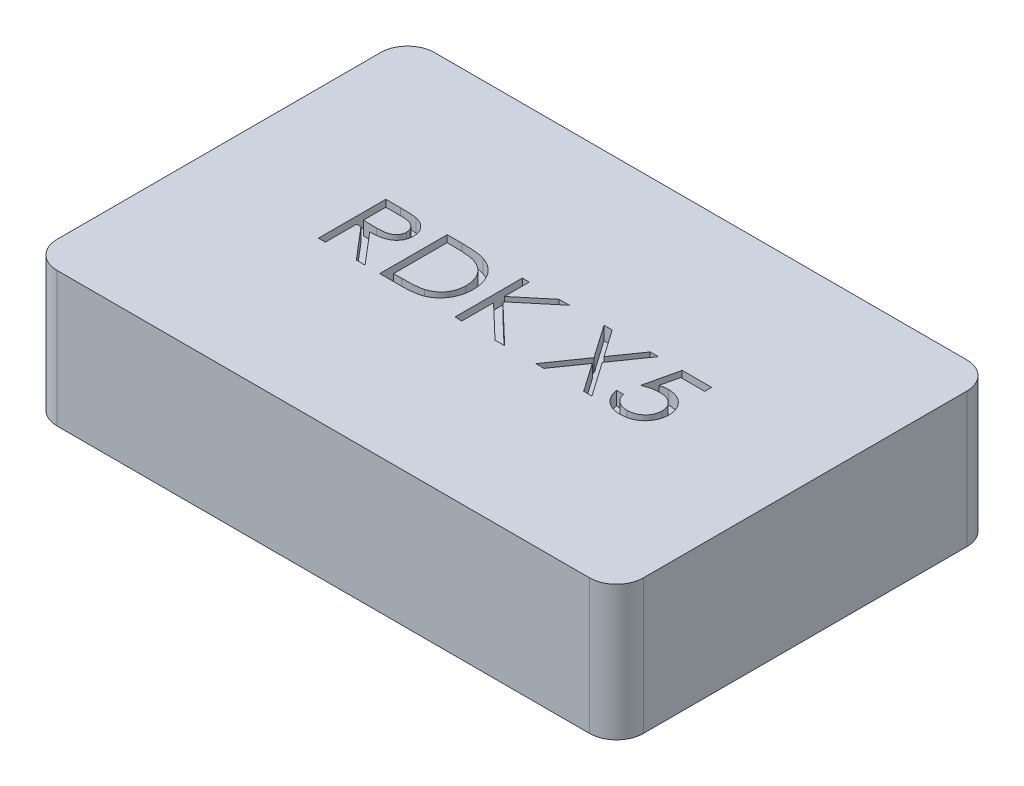
from build123d import *

# Parameters (mm, degrees)
SKETCH_1_W          = 87
SKETCH_1_H          = 56
EXTRUDE_1_DEPTH     = 20
FILLET_1_R          = 4
CUT_EXTRUDE_1_DEPTH = 2


with BuildPart() as part:
    # 草图1 → 凸台-拉伸1 (new body)
    with BuildSketch(Plane(origin=(0, 0, 0), x_dir=(1, 0, 0), z_dir=(0, 1, 0))):
        with Locations((19.168578004, -6.107640773)):
            Rectangle(SKETCH_1_W, SKETCH_1_H)
    extrude(amount=EXTRUDE_1_DEPTH)

    # 圆角1
    fillet_1_edges = [part.edges().sort_by_distance(p)[0] for p in [
        (-24.331421996, 10, -21.892359227),
        (62.668578004, 10, -21.892359227),
        (62.668578004, 10, 34.107640773),
        (-24.331421996, 10, 34.107640773),
    ]]
    fillet(fillet_1_edges, radius=FILLET_1_R)

    # 草图2 → 切除-拉伸1 (cut)
    # profile 1 of 5: a face of its own
    with BuildSketch(Plane(origin=(0, 20, 0), x_dir=(1, 0, 0), z_dir=(0, 1, 0))):
        with BuildLine():
            Line((-5.086722788, -0.572879549), (-2.923261249, -0.572879549))
            add(Edge.make_bspline(
                [(-2.923261249, -0.572879549), (-2.778363571, -0.573320934), (-2.50057369, -0.574167133), (-2.102513656, -0.578955925), (-1.74133814, -0.592548784), (-1.416592457, -0.604317135), (-1.128245794, -0.625823436), (-0.876136351, -0.645891733), (-0.660820705, -0.673220192), (-0.530674522, -0.69786254), (-0.471338172, -0.709097498)],
                knots=[0, 0, 0, 0, 1.414339765, 2.711494627, 3.88531881, 4.942159382, 5.882957806, 6.707302181, 7.410632199, 8, 8, 8, 8], degree=3))
            add(Edge.make_bspline(
                [(-0.471338172, -0.709097498), (-0.39217971, -0.727118538), (-0.236180601, -0.762632949), (-0.011132873, -0.838517799), (0.203372246, -0.926058972), (0.4070652, -1.028059668), (0.597749095, -1.147527371), (0.778375758, -1.279467313), (0.948001128, -1.426181319), (1.102530094, -1.588455044), (1.24633854, -1.760071337), (1.369865639, -1.944336992), (1.475400917, -2.137798329), (1.559421876, -2.341629454), (1.625296482, -2.554257223), (1.674272542, -2.776554138), (1.70195495, -3.008741261), (1.706065457, -3.166959882), (1.708149007, -3.247158396)],
                knots=[0, 0, 0, 0, 1.069961787, 2.10859435, 3.127328182, 4.123628923, 5.108344377, 6.091089374, 7.071029513, 8.061202237, 9.043197423, 10.020086572, 10.981454588, 11.944635557, 12.92219912, 13.913584836, 14.942429197, 16, 16, 16, 16], degree=3))
            add(Edge.make_bspline(
                [(1.708149007, -3.247158396), (1.707167418, -3.314650198), (1.705228873, -3.447940131), (1.684618015, -3.644814677), (1.650739701, -3.834890725), (1.60364341, -4.018652677), (1.547509403, -4.197412582), (1.470971987, -4.368132084), (1.386047608, -4.534164957), (1.254384435, -4.746338434), (1.057556343, -4.991116664), (0.775442435, -5.24896603), (0.44640417, -5.465990633), (0.13889931, -5.614198247), (-0.132845751, -5.710382876), (-0.357028875, -5.777478196), (-0.6011747, -5.829977365), (-0.862983344, -5.87643314), (-1.143799475, -5.911940207), (-1.443172574, -5.937713076), (-1.761227861, -5.953827929), (-1.979732276, -5.956250817), (-2.091931121, -5.957494934)],
                knots=[0, 0, 0, 0, 0.765727938, 1.51224032, 2.243597852, 2.954892557, 3.664246923, 4.366767899, 5.075150103, 5.77963024, 7.197468406, 8.624290223, 10.099748923, 11.655498899, 12.484879315, 13.369704222, 14.309208053, 15.317126835, 16.386797013, 17.520226779, 18.72667245, 20, 20, 20, 20], degree=3))
            Line((-2.091931121, -5.957494934), (1.836354135, -10.572879549))
            Line((1.836354135, -10.572879549), (0.532267597, -10.572879549))
            Line((0.532267597, -10.572879549), (-3.39601766, -5.957494934))
            Line((-3.39601766, -5.957494934), (-4.061081762, -5.957494934))
            Line((-4.061081762, -5.957494934), (-4.061081762, -10.572879549))
            Line((-4.061081762, -10.572879549), (-5.086722788, -10.572879549))
            Line((-5.086722788, -10.572879549), (-5.086722788, -0.572879549))
        make_face()
        with BuildLine():
            Line((-4.061081762, -1.598520575), (-4.061081762, -4.931853908))
            Line((-4.061081762, -4.931853908), (-2.125985608, -4.945876344))
            add(Edge.make_bspline(
                [(-2.125985608, -4.945876344), (-2.035158897, -4.945916152), (-1.859452652, -4.94599316), (-1.60571042, -4.93462199), (-1.369841411, -4.921534242), (-1.152648837, -4.901843435), (-0.953459435, -4.876030864), (-0.772880746, -4.844334721), (-0.610214022, -4.806720265), (-0.420540702, -4.74932722), (-0.208597691, -4.658102328), (0.02171773, -4.525482155), (0.217508872, -4.357476843), (0.385125331, -4.167566968), (0.516639621, -3.955712173), (0.612232033, -3.729400637), (0.673380617, -3.491427616), (0.679450507, -3.327651251), (0.682507981, -3.24515519)],
                knots=[0, 0, 0, 0, 1.174785523, 2.272648088, 3.285089017, 4.230573644, 5.09306652, 5.882666545, 6.601326979, 7.251640612, 8.443701465, 9.578459247, 10.675607977, 11.765284551, 12.843880664, 13.885096452, 14.934698485, 16, 16, 16, 16], degree=3))
            add(Edge.make_bspline(
                [(0.682507981, -3.24515519), (0.678381363, -3.164719582), (0.670198596, -3.00522195), (0.612837972, -2.771602025), (0.514951128, -2.55052413), (0.379400346, -2.345634499), (0.21741271, -2.156795082), (0.024213356, -1.998299093), (-0.190120634, -1.866039301), (-0.389379678, -1.782019439), (-0.567632848, -1.729518123), (-0.7228239, -1.69408289), (-0.898686728, -1.663975245), (-1.095371145, -1.64105525), (-1.312394295, -1.620747812), (-1.55024923, -1.607140768), (-1.808085907, -1.599117863), (-1.98709035, -1.598724533), (-2.07991189, -1.598520575)],
                knots=[0, 0, 0, 0, 1.061949867, 2.105764981, 3.156116539, 4.239743306, 5.339824676, 6.429463685, 7.526039854, 8.656250729, 9.272888371, 9.978850274, 10.757424844, 11.628143348, 12.593452775, 13.635925841, 14.774125383, 16, 16, 16, 16], degree=3))
            Line((-2.07991189, -1.598520575), (-4.061081762, -1.598520575))
        make_face(mode=Mode.SUBTRACT)
    # profile 2 of 5: a face of its own
    with BuildSketch(Plane(origin=(0, 20, 0), x_dir=(1, 0, 0), z_dir=(0, 1, 0))):
        with BuildLine():
            Line((4.015841315, -10.572879549), (4.015841315, -0.572879549))
            Line((4.015841315, -0.572879549), (6.225376571, -0.572879549))
            add(Edge.make_bspline(
                [(6.225376571, -0.572879549), (6.417694759, -0.574141819), (6.789045707, -0.57657916), (7.325422369, -0.592075121), (7.82114055, -0.619419152), (8.275357471, -0.659499632), (8.68923903, -0.708308279), (9.061696613, -0.769744538), (9.393857232, -0.842134295), (9.59843539, -0.904187918), (9.694927853, -0.933456472)],
                knots=[0, 0, 0, 0, 1.318491949, 2.545901884, 3.678445365, 4.721642567, 5.671598565, 6.534823525, 7.308926774, 8, 8, 8, 8], degree=3))
            add(Edge.make_bspline(
                [(9.694927853, -0.933456472), (9.821220395, -0.977576444), (10.070842097, -1.064781139), (10.427829177, -1.22805389), (10.763038591, -1.414803489), (11.078417894, -1.623664518), (11.369677001, -1.85878114), (11.643265297, -2.114412395), (11.892924453, -2.395448058), (12.121760365, -2.697987109), (12.324992302, -3.020190521), (12.504810388, -3.35762679), (12.654931343, -3.711069252), (12.777176612, -4.079740015), (12.873898205, -4.463246319), (12.941242355, -4.862468551), (12.981913074, -5.276225521), (12.98741107, -5.556761282), (12.990200289, -5.699081472)],
                knots=[0, 0, 0, 0, 1.031077272, 2.037960916, 3.02211781, 3.987428184, 4.950718056, 5.905008575, 6.871320757, 7.845447058, 8.826731165, 9.805580991, 10.790585977, 11.783751852, 12.797718923, 13.837143683, 14.902749073, 16, 16, 16, 16], degree=3))
            add(Edge.make_bspline(
                [(12.990200289, -5.699081472), (12.988696042, -5.822700914), (12.985730318, -6.066424872), (12.949684357, -6.425579874), (12.89576744, -6.773368803), (12.822992643, -7.110733073), (12.72373767, -7.436422022), (12.603377609, -7.750751403), (12.463552644, -8.054751572), (12.300328616, -8.343799054), (12.123841339, -8.619820931), (11.929802036, -8.877237336), (11.725111901, -9.116812303), (11.506269263, -9.337877175), (11.274924204, -9.538949469), (11.030974081, -9.722979883), (10.773663866, -9.887407969), (10.501108665, -10.035340867), (10.207895688, -10.164479968), (9.889064473, -10.275020701), (9.542386373, -10.365467655), (9.168543326, -10.44142591), (8.767425872, -10.501596597), (8.338087293, -10.542063087), (7.881042892, -10.569236887), (7.566898637, -10.571642043), (7.405264392, -10.572879549)],
                knots=[0, 0, 0, 0, 1.054853844, 2.079714579, 3.077722325, 4.058242422, 5.022929398, 5.980925057, 6.929583172, 7.876270073, 8.812240688, 9.724213697, 10.625598362, 11.500202141, 12.376883631, 13.239838843, 14.106288196, 14.981059116, 15.884459902, 16.838036739, 17.858370225, 18.940437825, 20.093157368, 21.318780153, 22.620452413, 24, 24, 24, 24], degree=3))
            Line((7.405264392, -10.572879549), (4.015841315, -10.572879549))
        make_face()
        with BuildLine():
            Line((5.04148234, -9.547238524), (6.281466315, -9.547238524))
            add(Edge.make_bspline(
                [(6.281466315, -9.547238524), (6.459758488, -9.546528354), (6.802364099, -9.545163693), (7.294582832, -9.533248723), (7.744748135, -9.513525208), (8.152285787, -9.486432129), (8.5169696, -9.450228906), (8.839375667, -9.40945084), (9.119442684, -9.359650805), (9.289856436, -9.313913304), (9.368405417, -9.292831472)],
                knots=[0, 0, 0, 0, 1.377932993, 2.64783117, 3.804968788, 4.860218214, 5.80403942, 6.636825548, 7.371670635, 8, 8, 8, 8], degree=3))
            add(Edge.make_bspline(
                [(9.368405417, -9.292831472), (9.467017978, -9.26074442), (9.661286497, -9.197532348), (9.941431758, -9.08138495), (10.203485203, -8.943953189), (10.452012874, -8.792897212), (10.680822296, -8.618235726), (10.895336739, -8.428926356), (11.093304233, -8.220150344), (11.275174732, -7.995076874), (11.43715083, -7.75289732), (11.577518755, -7.497079675), (11.698725196, -7.229661104), (11.797524027, -6.948357822), (11.870375889, -6.652821929), (11.924070317, -6.345623946), (11.960198578, -6.025792866), (11.963087478, -5.808023531), (11.964559263, -5.697078267)],
                knots=[0, 0, 0, 0, 1.0399027, 2.048627037, 3.037138908, 4.005479624, 4.961865202, 5.920171752, 6.872350524, 7.84404371, 8.819238837, 9.790447209, 10.767641088, 11.761041459, 12.77625925, 13.816787195, 14.88773541, 16, 16, 16, 16], degree=3))
            add(Edge.make_bspline(
                [(11.964559263, -5.697078267), (11.96209099, -5.580155261), (11.957242471, -5.35047921), (11.923802519, -5.012632167), (11.862685201, -4.688821053), (11.780404783, -4.377515567), (11.677602938, -4.077442118), (11.545250703, -3.792593584), (11.393832405, -3.518732311), (11.216657033, -3.261088687), (11.021150371, -3.01793782), (10.803928133, -2.79524722), (10.568022632, -2.592468092), (10.316002493, -2.406930291), (10.043102296, -2.24528256), (9.754308313, -2.099424096), (9.444476333, -1.977725781), (9.229325331, -1.91224156), (9.120007981, -1.878969293)],
                knots=[0, 0, 0, 0, 1.089998388, 2.141122879, 3.160582858, 4.158627459, 5.140999449, 6.113141423, 7.082948792, 8.055011043, 9.024278859, 9.98833552, 10.950481064, 11.921645981, 12.901668197, 13.903858501, 14.93495903, 16, 16, 16, 16], degree=3))
            add(Edge.make_bspline(
                [(9.120007981, -1.878969293), (9.029454437, -1.855755923), (8.836346684, -1.806252817), (8.522025724, -1.752814369), (8.167905175, -1.705115011), (7.773085506, -1.665152547), (7.337435535, -1.636202521), (6.861231815, -1.614658979), (6.344323861, -1.600035744), (5.986338188, -1.599037984), (5.800697084, -1.598520575)],
                knots=[0, 0, 0, 0, 0.671630374, 1.43226897, 2.289500064, 3.239801583, 4.283712342, 5.427140445, 6.66578882, 8, 8, 8, 8], degree=3))
            Line((5.800697084, -1.598520575), (5.04148234, -1.598520575))
            Line((5.04148234, -1.598520575), (5.04148234, -9.547238524))
        make_face(mode=Mode.SUBTRACT)
    # profile 3 of 5: a face of its own
    with BuildSketch(Plane(origin=(0, 20, 0), x_dir=(1, 0, 0), z_dir=(0, 1, 0))):
        Polygon((15.169687469, -0.572879549), (16.195328494, -0.572879549), (16.195328494, -4.266789806), (20.626418238, -0.572879549), (22.156866956, -0.572879549), (16.774254776, -5.060059037), (22.54148234, -10.572879549), (21.113197084, -10.572879549), (16.195328494, -5.869353908), (16.195328494, -10.572879549), (15.169687469, -10.572879549), align=None)
    # profile 4 of 5: a face of its own
    with BuildSketch(Plane(origin=(0, 20, 0), x_dir=(1, 0, 0), z_dir=(0, 1, 0))):
        Polygon((27.285072084, -0.572879549), (28.505024007, -0.572879549), (31.323533622, -4.607334678), (34.140040033, -0.572879549), (35.361995161, -0.572879549), (31.934511187, -5.482735319), (35.490200289, -10.572879549), (34.272251571, -10.572879549), (31.325536828, -6.354129549), (28.378822084, -10.572879549), (27.156866956, -10.572879549), (30.712556058, -5.478728908), align=None)
    # profile 5 of 5: a face of its own
    with BuildSketch(Plane(origin=(0, 20, 0), x_dir=(1, 0, 0), z_dir=(0, 1, 0))):
        with BuildLine():
            Line((43.246610546, -0.572879549), (43.246610546, -1.598520575))
            Line((43.246610546, -1.598520575), (39.700937469, -1.598520575))
            Line((39.700937469, -1.598520575), (39.089959905, -4.240748139))
            add(Edge.make_bspline(
                [(39.089959905, -4.240748139), (39.201077595, -4.209061697), (39.416394662, -4.147661647), (39.735376731, -4.085326199), (40.036894775, -4.040880462), (40.232974624, -4.036526659), (40.327940674, -4.034418011)],
                knots=[0, 0, 0, 0, 1.100584957, 2.132646227, 3.095596962, 4, 4, 4, 4], degree=3))
            add(Edge.make_bspline(
                [(40.327940674, -4.034418011), (40.444940861, -4.0368504), (40.675129681, -4.041635937), (41.01171814, -4.087033603), (41.332980489, -4.159047155), (41.638357192, -4.259347041), (41.929099325, -4.387501133), (42.20250032, -4.547892094), (42.462506184, -4.733687179), (42.701269453, -4.950353269), (42.918167697, -5.187333227), (43.111440224, -5.440609426), (43.270542381, -5.712775002), (43.405927132, -5.998537252), (43.503888816, -6.303666848), (43.579154089, -6.622889173), (43.623928715, -6.95916497), (43.628762121, -7.188665183), (43.63122593, -7.305651985)],
                knots=[0, 0, 0, 0, 1.077151714, 2.119212705, 3.121851832, 4.105966215, 5.075130764, 6.042439667, 7.020500988, 8.01341629, 9.005912455, 9.976422566, 10.941539175, 11.904595977, 12.882869982, 13.886885156, 14.922848286, 16, 16, 16, 16], degree=3))
            add(Edge.make_bspline(
                [(43.63122593, -7.305651985), (43.629516001, -7.38715886), (43.626118031, -7.549129317), (43.604111273, -7.789485794), (43.565803826, -8.025047009), (43.512073555, -8.25547046), (43.441223142, -8.479954817), (43.357207582, -8.699860453), (43.256010874, -8.913940136), (43.14347661, -9.123767619), (43.01483792, -9.322950437), (42.876851395, -9.51258229), (42.725985742, -9.688519895), (42.565533058, -9.854040514), (42.392754471, -10.005853535), (42.209912687, -10.147143082), (42.0153094, -10.274972752), (41.810463917, -10.391155816), (41.597059125, -10.495972109), (41.373205538, -10.583179947), (41.143433298, -10.659675725), (40.904688987, -10.72247912), (40.657647536, -10.76992836), (40.402061171, -10.803138668), (40.139424135, -10.827071456), (39.961410064, -10.828543777), (39.871209905, -10.829289806)],
                knots=[0, 0, 0, 0, 1.016499425, 2.019987615, 3.007067189, 3.990768755, 4.967927679, 5.940676635, 6.924201944, 7.919118939, 8.907813052, 9.878849546, 10.841710254, 11.795707484, 12.751447708, 13.707514388, 14.675260193, 15.652383633, 16.643074722, 17.637399078, 18.645988148, 19.661975783, 20.713747707, 21.780771562, 22.875511604, 24, 24, 24, 24], degree=3))
            add(Edge.make_bspline(
                [(39.871209905, -10.829289806), (39.763568976, -10.827320213), (39.552258461, -10.823453696), (39.243022038, -10.783034311), (38.945602102, -10.724290759), (38.661508177, -10.637546366), (38.389029324, -10.527951436), (38.132317974, -10.389615746), (37.885625832, -10.231403848), (37.655014865, -10.047309685), (37.44127821, -9.844612955), (37.250723651, -9.623929007), (37.077821489, -9.392522741), (36.935658495, -9.141585938), (36.808589416, -8.880601783), (36.709981543, -8.602667504), (36.630315981, -8.311465987), (36.596895595, -8.11064087), (36.579943879, -8.008776985)],
                knots=[0, 0, 0, 0, 1.085877747, 2.131692758, 3.142880474, 4.14286505, 5.125366391, 6.102257235, 7.081864604, 8.079734589, 9.076078377, 10.05059479, 11.019852918, 11.986271429, 12.957004748, 13.94627934, 14.958297804, 16, 16, 16, 16], degree=3))
            Line((36.579943879, -8.008776985), (37.605584905, -8.008776985))
            add(Edge.make_bspline(
                [(37.605584905, -8.008776985), (37.629021368, -8.104156988), (37.674104088, -8.287631342), (37.771032444, -8.545620233), (37.891091262, -8.775376171), (38.035027716, -8.979191597), (38.204669912, -9.158000689), (38.399297713, -9.316760608), (38.617778405, -9.459433144), (38.859733331, -9.579586854), (39.115127849, -9.680504252), (39.382380673, -9.749374691), (39.654548836, -9.796265078), (39.838962428, -9.801185112), (39.931306058, -9.80364878)],
                knots=[0, 0, 0, 0, 1.105255689, 2.126085831, 3.094714204, 4.016847766, 4.926388513, 5.861187163, 6.839282794, 7.858145028, 8.898395173, 9.925188997, 10.961054995, 12, 12, 12, 12], degree=3))
            add(Edge.make_bspline(
                [(39.931306058, -9.80364878), (40.021571448, -9.801326332), (40.198750382, -9.796767675), (40.459418353, -9.761143453), (40.710819593, -9.706436854), (40.951376945, -9.624555546), (41.184884372, -9.525069853), (41.40573614, -9.397892936), (41.618693449, -9.250386054), (41.818323206, -9.081828468), (42.002292375, -8.896901199), (42.163688685, -8.697705719), (42.300100405, -8.486566548), (42.413861334, -8.265039846), (42.500318036, -8.031575547), (42.559263779, -7.786669161), (42.599731636, -7.531349024), (42.603610473, -7.356562239), (42.605584905, -7.267591088)],
                knots=[0, 0, 0, 0, 1.055051283, 2.070925109, 3.071045655, 4.058623374, 5.037677312, 6.034164763, 7.032607791, 8.063255273, 9.08460474, 10.078366321, 11.055051477, 12.018762383, 12.984653025, 13.957962099, 14.960548061, 16, 16, 16, 16], degree=3))
            add(Edge.make_bspline(
                [(42.605584905, -7.267591088), (42.604136007, -7.187316505), (42.601296644, -7.030004643), (42.565044448, -6.800770774), (42.512128729, -6.582831266), (42.435069812, -6.376602414), (42.336403696, -6.182199419), (42.217945405, -5.997448639), (42.07423431, -5.82765259), (41.911874551, -5.669346023), (41.732639682, -5.525601379), (41.53692827, -5.399845662), (41.324706185, -5.297119067), (41.100750135, -5.206963684), (40.860315774, -5.142547062), (40.606722096, -5.093651285), (40.337894025, -5.066111917), (40.153720899, -5.062107439), (40.059511187, -5.060059037)],
                knots=[0, 0, 0, 0, 1.015670352, 1.990380851, 2.931800134, 3.852286557, 4.771295661, 5.688435274, 6.625018434, 7.581846215, 8.556520028, 9.530055911, 10.520920521, 11.538525318, 12.582836159, 13.667522609, 14.806872476, 16, 16, 16, 16], degree=3))
            add(Edge.make_bspline(
                [(40.059511187, -5.060059037), (39.977325109, -5.061679051), (39.808617482, -5.065004537), (39.549175724, -5.090653748), (39.277088611, -5.130673731), (38.992389355, -5.187229992), (38.695147972, -5.259996246), (38.385141597, -5.348267741), (38.062344592, -5.452299743), (37.845034741, -5.532052645), (37.733790033, -5.572879549)],
                knots=[0, 0, 0, 0, 0.823935763, 1.691335702, 2.611665863, 3.580679742, 4.600450859, 5.679197418, 6.811940615, 8, 8, 8, 8], degree=3))
            Line((37.733790033, -5.572879549), (38.887636187, -0.572879549))
            Line((38.887636187, -0.572879549), (43.246610546, -0.572879549))
        make_face()
    extrude(amount=-CUT_EXTRUDE_1_DEPTH, mode=Mode.SUBTRACT)


solid = part.part
